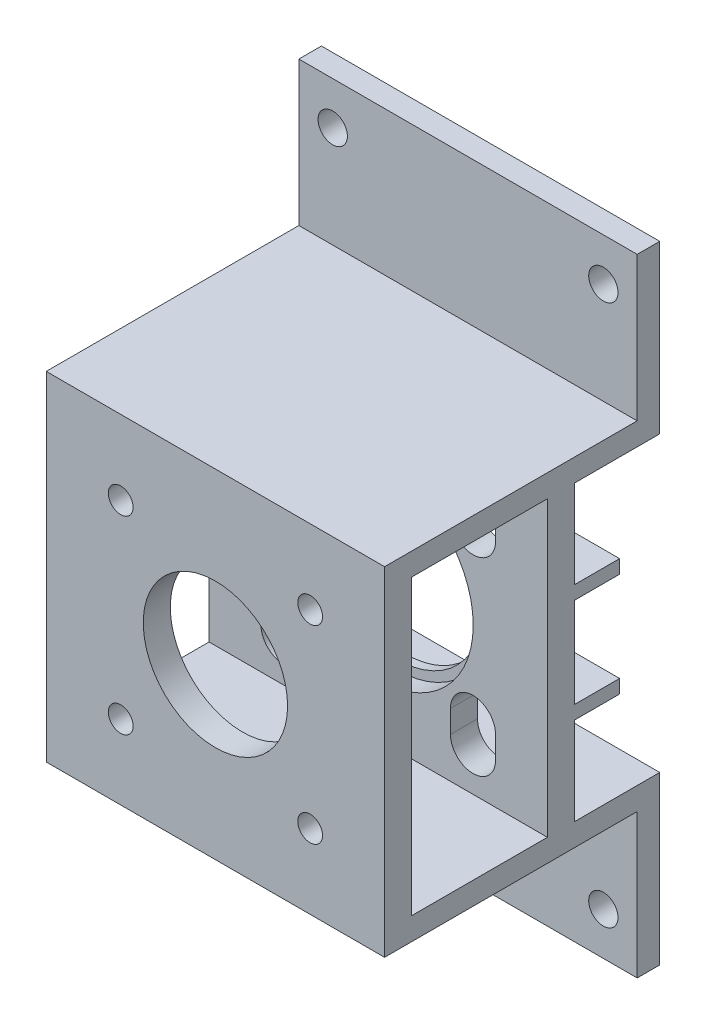
from build123d import *

# Parameters (mm, degrees)
SKETCH1_W           = 75
SKETCH1_H           = 75
SKETCH1_R           = 2.75
SKETCH1_R_2         = 16
BOSS_EXTRUDE1_DEPTH = 6
BOSS_EXTRUDE2_DEPTH = 75
SKETCH3_R           = 21.05
CUT_EXTRUDE1_DEPTH  = 6
SKETCH4_R           = 21.05
SKETCH4_R_2         = 19.05
BOSS_EXTRUDE3_DEPTH = 2
SKETCH5_R           = 3.25
CUT_EXTRUDE2_DEPTH  = 97.785892457
CUT_EXTRUDE3_DEPTH  = 6
SKETCH7_R           = 1.25
BOSS_EXTRUDE4_DEPTH = 10
SKETCH11_W          = 6.5
SKETCH11_H          = 26
CUT_EXTRUDE7_DEPTH  = 10


with BuildPart() as part:
    # Sketch1 → Boss-Extrude1 (new body)
    with BuildSketch(Plane.XY):
        Rectangle(SKETCH1_W, SKETCH1_H)
        with Locations((21, 21)):
            Circle(SKETCH1_R, mode=Mode.SUBTRACT)
        with Locations((21, -21)):
            Circle(SKETCH1_R, mode=Mode.SUBTRACT)
        with Locations((-21, -21)):
            Circle(SKETCH1_R, mode=Mode.SUBTRACT)
        with Locations((-21, 21)):
            Circle(SKETCH1_R, mode=Mode.SUBTRACT)
        Circle(SKETCH1_R_2, mode=Mode.SUBTRACT)
    extrude(amount=BOSS_EXTRUDE1_DEPTH)

    # Sketch2 → Boss-Extrude2 (add)
    with BuildSketch(Plane.ZY.offset(37.5)):
        Polygon((0, 37.5), (-50, 37.5), (-50, 69.464084092), (-55, 69.464084092), (-55, 32.5), (-36.09839393, 32.5), (-36.09839393, -32.5), (-55, -32.5), (-55, -69.464084092), (-50, -69.464084092), (-50, -37.5), (0, -37.5), (0, -32.5), (-30.09839393, -32.5), (-30.09839393, 32.5), (0, 32.5), align=None)
    extrude(amount=-BOSS_EXTRUDE2_DEPTH)

    # Sketch3 → Cut-Extrude1 (cut)
    with BuildSketch(Plane(origin=(0, 0, -36.09839393), x_dir=(-1, 0, 0), z_dir=(0, 0, -1))):
        Circle(SKETCH3_R)
    extrude(amount=-CUT_EXTRUDE1_DEPTH, mode=Mode.SUBTRACT)

    # Sketch4 → Boss-Extrude3 (add)
    with BuildSketch(Plane(origin=(0, 0, -36.09839393), x_dir=(-1, 0, 0), z_dir=(0, 0, -1))):
        Circle(SKETCH4_R)
        Circle(SKETCH4_R_2, mode=Mode.SUBTRACT)
    extrude(amount=-BOSS_EXTRUDE3_DEPTH)

    # Sketch5 → Cut-Extrude2 (cut, through all)
    with BuildSketch(Plane.XY.offset(-50)):
        with Locations((30, -60)):
            Circle(SKETCH5_R)
        with Locations((-30, -60)):
            Circle(SKETCH5_R)
    cut_extrude2 = extrude(amount=-CUT_EXTRUDE2_DEPTH, mode=Mode.SUBTRACT)

    # Mirror1: Cut-Extrude2 across plane
    add(cut_extrude2.mirror(Plane.ZX), mode=Mode.SUBTRACT)

    # Sketch6 → Cut-Extrude3 (cut)
    with BuildSketch(Plane(origin=(0, 0, -36.09839393), x_dir=(-1, 0, 0), z_dir=(0, 0, -1))):
        with BuildLine():
            Line((26, 23.5), (26, 18.5))
            ThreePointArc((26, 18.5), (21, 13.5), (16, 18.5))
            Line((16, 18.5), (16, 23.5))
            ThreePointArc((16, 23.5), (21, 28.5), (26, 23.5))
        make_face()
        with BuildLine():
            Line((16, -23.5), (16, -18.5))
            ThreePointArc((16, -18.5), (21, -13.5), (26, -18.5))
            Line((26, -18.5), (26, -23.5))
            ThreePointArc((26, -23.5), (21, -28.5), (16, -23.5))
        make_face()
        with BuildLine():
            Line((-16, -23.5), (-16, -18.5))
            ThreePointArc((-16, -18.5), (-21, -13.5), (-26, -18.5))
            Line((-26, -18.5), (-26, -23.5))
            ThreePointArc((-26, -23.5), (-21, -28.5), (-16, -23.5))
        make_face()
        with BuildLine():
            Line((-26, 23.5), (-26, 18.5))
            ThreePointArc((-26, 18.5), (-21, 13.5), (-16, 18.5))
            Line((-16, 18.5), (-16, 23.5))
            ThreePointArc((-16, 23.5), (-21, 28.5), (-26, 23.5))
        make_face()
    extrude(amount=-CUT_EXTRUDE3_DEPTH, mode=Mode.SUBTRACT)

    # Sketch7 → Boss-Extrude4 (add)
    # profile 1 of 2: a face of its own
    with BuildSketch(Plane(origin=(0, 0, -36.09839393), x_dir=(-1, 0, 0), z_dir=(0, 0, -1))):
        Polygon((-26, -3), (-21, -3), (-21, -13), (-37.5, -13), (-37.5, -10), (-26, -10), align=None)
        with Locations(Location((-23.5, -5, 0), (0, 0, 180))):
            Circle(SKETCH7_R, mode=Mode.SUBTRACT)
    # profile 2 of 2: a face of its own
    with BuildSketch(Plane(origin=(0, 0, -36.09839393), x_dir=(-1, 0, 0), z_dir=(0, 0, -1))):
        Polygon((-21, 13), (-37.5, 13), (-37.5, 10), (-26, 10), (-26, 3), (-21, 3), align=None)
        with Locations((-23.5, 5)):
            Circle(SKETCH7_R, mode=Mode.SUBTRACT)
    extrude(amount=BOSS_EXTRUDE4_DEPTH)

    # Sketch11 → Cut-Extrude7 (cut)
    with BuildSketch(Plane.ZY.offset(-21)):
        with Locations((-39.34839393, 0)):
            Rectangle(SKETCH11_W, SKETCH11_H)
    extrude(amount=-CUT_EXTRUDE7_DEPTH, mode=Mode.SUBTRACT)


solid = part.part
